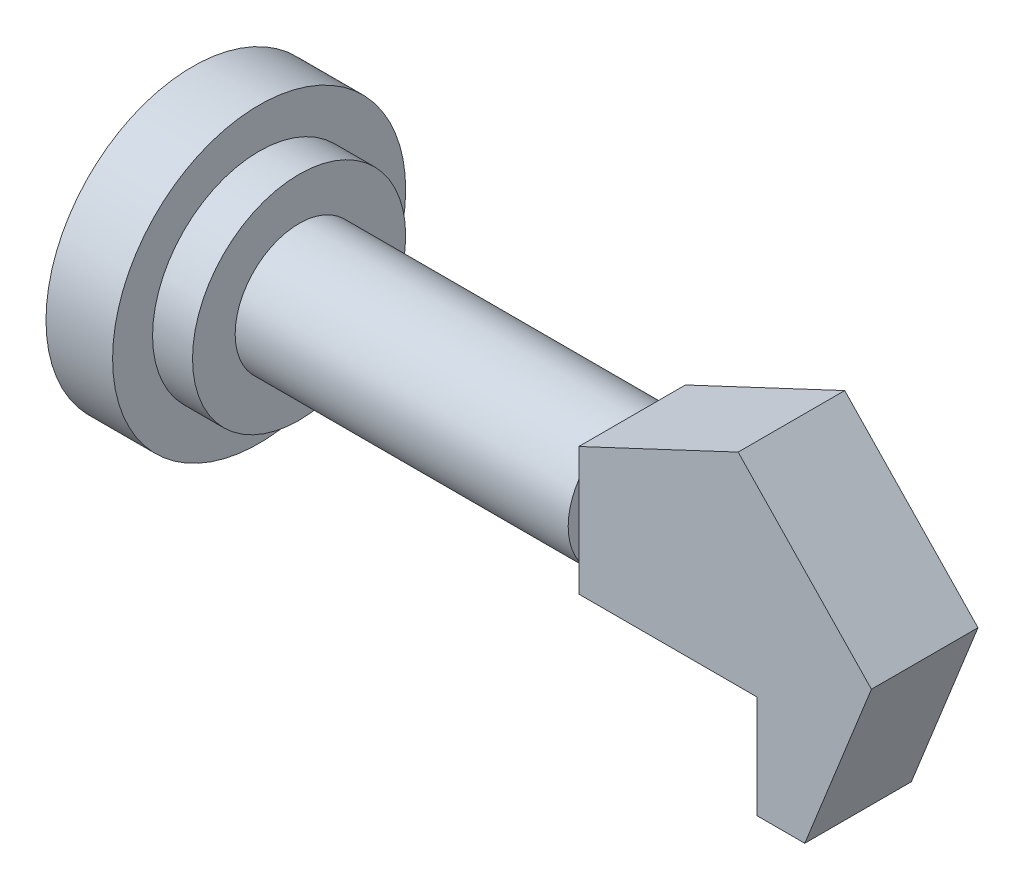
from build123d import *

# Parameters (mm, degrees)
EXTRUDE_1_DEPTH      = 4
EXTRUDE_1_DEPTH_BACK = 4


with BuildPart() as part:
    # Эскиз1 → Повернуть1 (revolve)
    with BuildSketch(Plane.XY):
        Polygon((0, 11), (0, 0), (5, 0), (5, 3), (8, 3), (8, 6.2), (33, 6.2), (33, 11), align=None)
    revolve(axis=Axis((0, 11, 0), (1, 0, 0)))

    # Эскиз1<3> → Бобышка-Вытянуть1 (add, two sides: drawn at the far end of the back side and taken through both)
    with BuildSketch(Plane.XY.offset(-EXTRUDE_1_DEPTH_BACK)):
        Polygon((33, 15.8), (33, 6.2), (46.388094458, 6.2), (46.388094458, -1.517423247), (49.961353524, -1.517423247), (54.964630107, 11), (44.95807694, 21.414261094), align=None)
    extrude(amount=EXTRUDE_1_DEPTH + EXTRUDE_1_DEPTH_BACK)


solid = part.part
